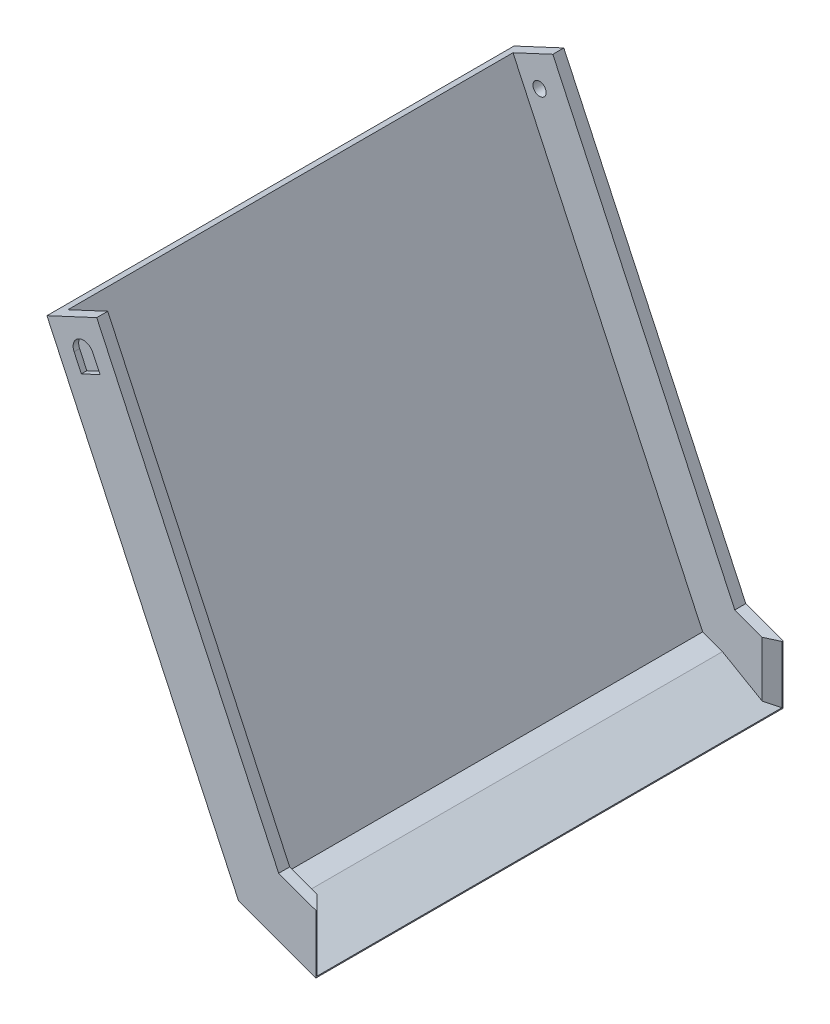
from build123d import *

# Parameters (mm, degrees)
EXTRUDE_1_DEPTH     = 170
SHELL_7_T           = -4
CUT_EXTRUDE_2_DEPTH = 2
CUT_EXTRUDE_4_DEPTH = 162
CHAMFER_2_SIZE      = 3.6
SKETCH_7_R          = 2.4
CUT_EXTRUDE_5_DEPTH = 10


with BuildPart() as part:
    # 草图1 → 凸台-拉伸1 (new body)
    with BuildSketch(Plane.XY):
        Polygon((0, 0), (0, -21.28355545), (-28.190778624, -11.02295115), (-97.922791811, 138.517833711), (-79.79663607, 146.970198946), (-13.565707197, 4.937513627), align=None)
    extrude(amount=EXTRUDE_1_DEPTH)

    # 抽壳7
    shell_7_openings = [part.faces().sort_by_distance(p)[0] for p in [
        (0, -10.641777725, 85),
        (-6.782853599, 2.468756813, 85),
        (-46.681171634, 75.953856286, 85),
        (-88.85971394, 142.744016329, 85),
    ]]
    offset(amount=SHELL_7_T, openings=shell_7_openings, kind=Kind.INTERSECTION)

    # 草图4 → 切除-拉伸2 (cut)
    with BuildSketch(Plane.XY.offset(170)):
        with BuildLine():
            Line((-81.234877122, 135.26575694), (-78.593512986, 129.601333271))
            Line((-78.593512986, 129.601333271), (-85.390821389, 126.431696308))
            Line((-85.390821389, 126.431696308), (-88.032185524, 132.096119977))
            ThreePointArc((-88.032185524, 132.096119977), (-86.218349805, 137.07959266), (-81.234877122, 135.26575694))
        make_face()
    extrude(amount=-CUT_EXTRUDE_2_DEPTH, mode=Mode.SUBTRACT)

    # 草图2 → 切除-拉伸4 (cut)
    with BuildSketch(Plane.XY.offset(4)):
        Polygon((0, -20.88355545), (-19.529222148, -9.608353785), (0, -9.608353785), align=None)
    extrude(amount=CUT_EXTRUDE_4_DEPTH, mode=Mode.SUBTRACT)

    # 倒角2
    chamfer_2_edges = [part.edges().sort_by_distance(p)[0] for p in [
        (0, -10.441777725, 166),
        (0, -10.441777725, 4),
    ]]
    chamfer(chamfer_2_edges, length=CHAMFER_2_SIZE)

    # 草图7 → 切除-拉伸5 (cut)
    with BuildSketch(Plane(origin=(0, 0, 0), x_dir=(-1, 0, 0), z_dir=(0, 0, -1))):
        with Locations((84.633531323, 133.680938458)):
            Circle(SKETCH_7_R)
    extrude(amount=-CUT_EXTRUDE_5_DEPTH, mode=Mode.SUBTRACT)


solid = part.part
